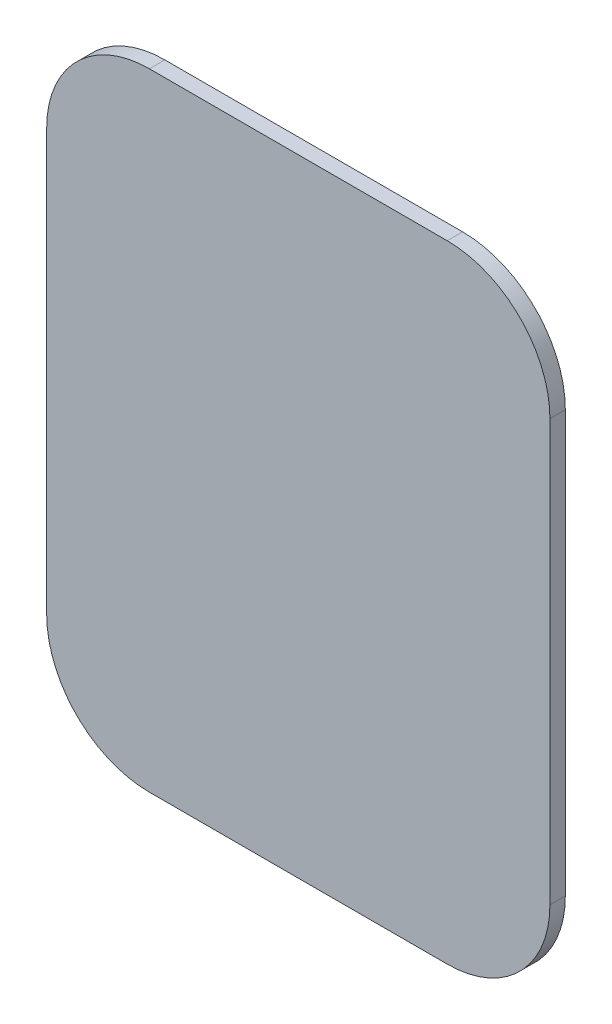
from build123d import *

# Parameters (mm, degrees)
SKETCH_1_W      = 98
SKETCH_1_H      = 122
EXTRUDE_1_DEPTH = 3
FILLET_1_R      = 20


with BuildPart() as part:
    # 草图1 → 凸台-拉伸1 (new body)
    with BuildSketch(Plane.XY):
        Rectangle(SKETCH_1_W, SKETCH_1_H)
    extrude(amount=EXTRUDE_1_DEPTH)

    # 圆角1
    fillet_1_edges = [part.edges().sort_by_distance(p)[0] for p in [
        (49, -61, 1.5),
        (-49, -61, 1.5),
        (-49, 61, 1.5),
        (49, 61, 1.5),
    ]]
    fillet(fillet_1_edges, radius=FILLET_1_R)


solid = part.part
